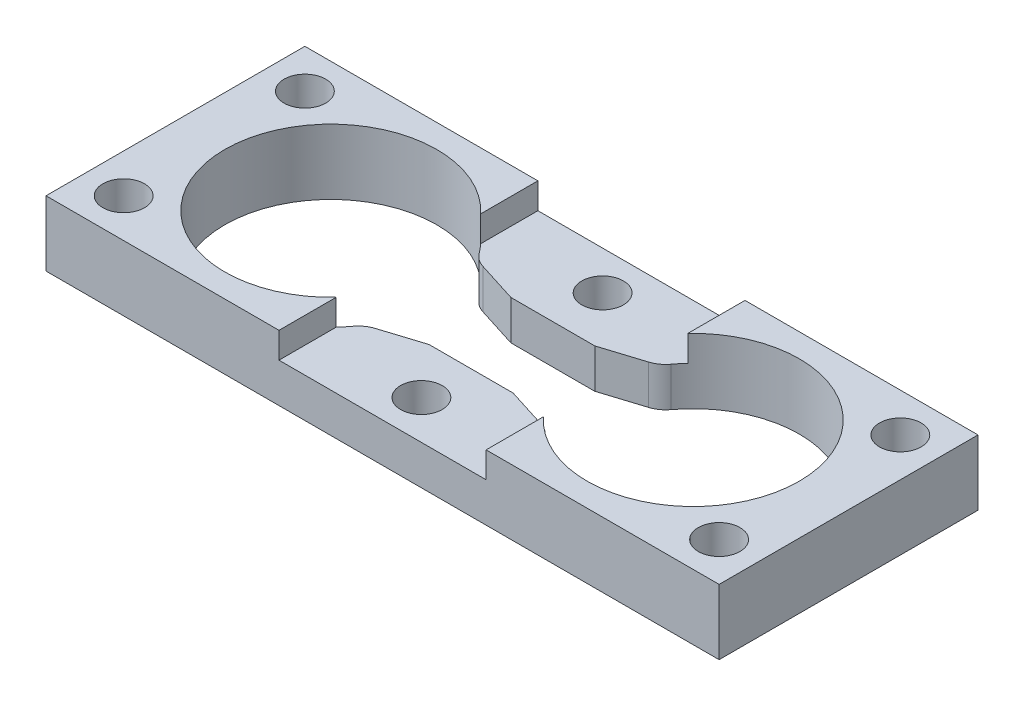
from build123d import *

# Parameters (mm, degrees)
SKETCH1_W              = 82.55
SKETCH1_H              = 31.75
PLATE_DEPTH            = 4
F_10_CLEARANCE_HOLE1_D = 5.1054
LOAD_CELL_CUTOUT_REACH = 46.94
FILLET1_R              = 3.175
SKETCH8_W              = 25.4
SKETCH8_H              = 3.175
CABLE_CUTOUT_DEPTH     = 53.227273766


with BuildPart() as part:
    # Sketch1 → Plate (new, symmetric)
    with BuildSketch(Plane(origin=(0, 0, 0), x_dir=(1, 0, 0), z_dir=(0, 1, 0))):
        Rectangle(SKETCH1_W, SKETCH1_H)
    extrude(amount=PLATE_DEPTH, both=True)

    # #10 Clearance Hole1 (through all)
    with Locations(Plane(origin=(0, 4, 0), x_dir=(1, 0, 0), z_dir=(0, 1, 0))):
        with Locations((-36.5125, 11.1125), (36.5125, 11.1125), (36.5125, -11.1125), (-36.5125, -11.1125), (0, -11.1125), (0, 11.1125)):
            Hole(F_10_CLEARANCE_HOLE1_D / 2)

    # Sketch4 → Load Cell Cutout (cut, up to next)
    with BuildSketch(Plane(origin=(0, 4, 0), x_dir=(1, 0, 0), z_dir=(0, 1, 0)), mode=Mode.PRIVATE) as load_cell_cutout_sk1:
        with BuildLine():
            Line((-11.215130837, 6.927542495), (-5.146572344, 5.008))
            Line((-5.146572344, 5.008), (0.508, 5.008))
            Line((0.508, 5.008), (0.508, -5.008))
            Line((0.508, -5.008), (-5.146572344, -5.008))
            Line((-5.146572344, -5.008), (-11.215130837, -6.927542495))
            ThreePointArc((-11.215130837, -6.927542495), (-35.233, 0), (-11.215130837, 6.927542495))
        make_face()
    load_cell_cutout_tool1 = extrude(load_cell_cutout_sk1.sketch, amount=-LOAD_CELL_CUTOUT_REACH, mode=Mode.PRIVATE) & part.part
    load_cell_cutout = load_cell_cutout_tool1.solids().sort_by_distance((-19.247543, 4, 0))[0]
    add(load_cell_cutout, mode=Mode.SUBTRACT)

    # Cutout Mirror: Load Cell Cutout across plane
    add(load_cell_cutout.mirror(Plane(origin=(0, 0, 0), x_dir=(0, 0, 1), z_dir=(1, 0, 0))), mode=Mode.SUBTRACT)

    # Fillet1
    fillet1_edges = [part.edges().sort_by_distance(p)[0] for p in [
        (-11.215130837, 0, 6.927542495),
        (-11.215130837, 0, -6.927542495),
        (11.215130837, 0, -6.927542495),
        (11.215130837, 0, 6.927542495),
    ]]
    fillet(fillet1_edges, radius=FILLET1_R)

    # Sketch8 → Cable Cutout (cut, through all)
    with BuildSketch(Plane.XY.offset(15.875)):
        with Locations((0, 2.4125)):
            Rectangle(SKETCH8_W, SKETCH8_H)
    extrude(amount=-CABLE_CUTOUT_DEPTH, mode=Mode.SUBTRACT)


solid = part.part
